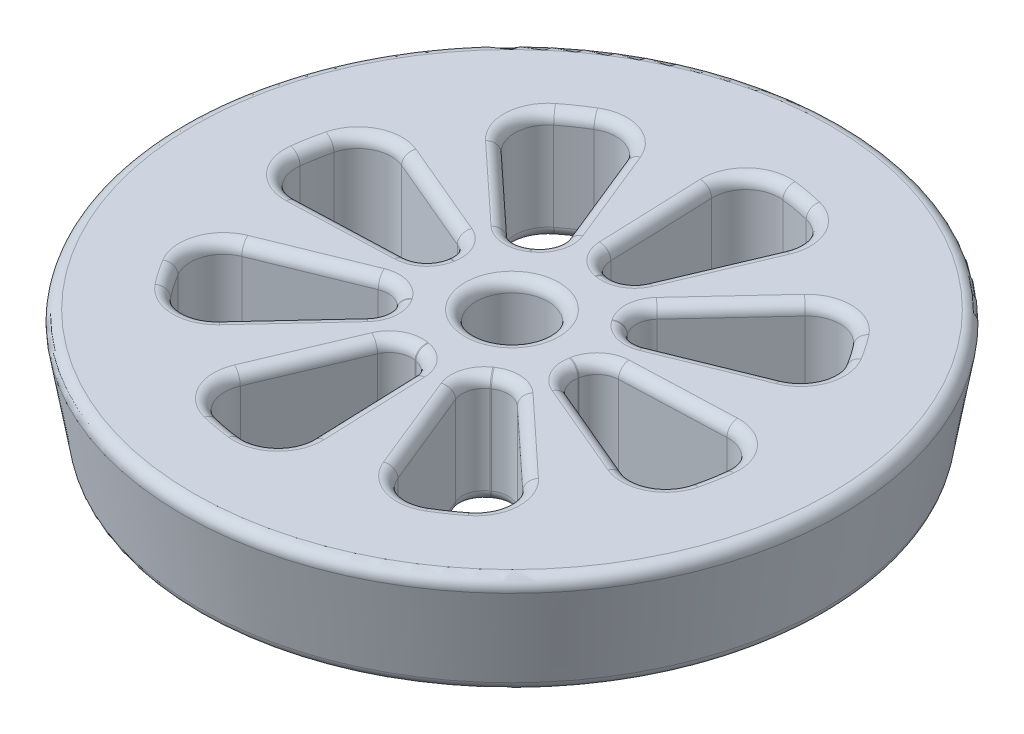
from build123d import *

# Parameters (mm, degrees)
SKETCH_1_R          = 30
SKETCH_1_R_2        = 22
EXTRUDE_1_DEPTH     = 10
SKETCH_1_R_3        = 7.5
SKETCH_1_R_4        = 3.25
EXTRUDE_1_2_DEPTH   = 10
EXTRUDE_3_DEPTH     = 10
FILLET_1_R          = 3
FILLET_3_R          = 2
SKETCH_3_R          = 58.089132302
SKETCH_3_R_2        = 30
CUT_EXTRUDE_1_DEPTH = 44.588989435
CUT_EXTRUDE_1_DRAFT = 10
FILLET_4_R          = 1


with BuildPart() as part:
    # 草圖1 → 填料-伸長1 (new body)
    with BuildSketch(Plane(origin=(0, 0, 0), x_dir=(1, 0, 0), z_dir=(0, 1, 0))):
        with Locations(Location((0, 0, 0), (0, 0, 270))):
            Circle(SKETCH_1_R)
        with Locations(Location((0, 0, 0), (0, 0, 270))):
            Circle(SKETCH_1_R_2, mode=Mode.SUBTRACT)
    extrude(amount=EXTRUDE_1_DEPTH)



with BuildPart() as body_2:
    # 草圖1 → Extrude 1 2 (new body)
    with BuildSketch(Plane(origin=(0, 0, 0), x_dir=(1, 0, 0), z_dir=(0, 1, 0))):
        with Locations(Location((0, 0, 0), (0, 0, 270))):
            Circle(SKETCH_1_R_3)
        with Locations(Location((0, 0, 0), (0, 0, 270))):
            Circle(SKETCH_1_R_4, mode=Mode.SUBTRACT)
    extrude(amount=EXTRUDE_1_2_DEPTH)


with BuildPart() as part_1:
    add(part.part)

    add(body_2.part)  # 填料-伸長3 merges body 2
    # 草圖2 → 填料-伸長3 (add, through all)
    with BuildSketch(Plane(origin=(0, 10, 0), x_dir=(1, 0, 0), z_dir=(0, 1, 0))):
        with BuildLine():
            Line((-8.281693583, 20.38169648), (-2.82330463, 6.948305618))
            ThreePointArc((-2.82330463, 6.948305618), (-1.573851681, 7.333006947), (-0.276578044, 7.494898571))
            Line((-0.276578044, 7.494898571), (-0.811295596, 21.985035807))
            ThreePointArc((-0.811295596, 21.985035807), (-4.616631597, 21.510153712), (-8.281693583, 20.38169648))
        make_face()
        with BuildLine():
            ThreePointArc((2.916816171, 6.90957187), (4.072337743, 6.298100135), (5.104123393, 5.495263814))
            Line((5.104123393, 5.495263814), (14.972095287, 16.119440522))
            ThreePointArc((14.972095287, 16.119440522), (11.945524046, 18.474427062), (8.555994101, 20.268077485))
            Line((8.555994101, 20.268077485), (2.916816171, 6.90957187))
        make_face()
        with BuildLine():
            ThreePointArc((6.948305618, 2.82330463), (7.333006947, 1.573851681), (7.494898571, 0.276578044))
            Line((7.494898571, 0.276578044), (21.985035807, 0.811295596))
            ThreePointArc((21.985035807, 0.811295596), (21.510153712, 4.616631597), (20.38169648, 8.281693583))
            Line((20.38169648, 8.281693583), (6.948305618, 2.82330463))
        make_face()
        with BuildLine():
            ThreePointArc((6.90957187, -2.916816171), (6.298100135, -4.072337743), (5.495263814, -5.104123393))
            Line((5.495263814, -5.104123393), (16.119440522, -14.972095287))
            ThreePointArc((16.119440522, -14.972095287), (18.474427062, -11.945524046), (20.268077485, -8.555994101))
            Line((20.268077485, -8.555994101), (6.90957187, -2.916816171))
        make_face()
        with BuildLine():
            ThreePointArc((2.82330463, -6.948305618), (1.573851681, -7.333006947), (0.276578044, -7.494898571))
            Line((0.276578044, -7.494898571), (0.811295596, -21.985035807))
            ThreePointArc((0.811295596, -21.985035807), (4.616631597, -21.510153712), (8.281693583, -20.38169648))
            Line((8.281693583, -20.38169648), (2.82330463, -6.948305618))
        make_face()
        with BuildLine():
            ThreePointArc((-2.916816171, -6.90957187), (-4.072337743, -6.298100135), (-5.104123393, -5.495263814))
            Line((-5.104123393, -5.495263814), (-14.972095287, -16.119440522))
            ThreePointArc((-14.972095287, -16.119440522), (-11.945524046, -18.474427062), (-8.555994101, -20.268077485))
            Line((-8.555994101, -20.268077485), (-2.916816171, -6.90957187))
        make_face()
        with BuildLine():
            ThreePointArc((-6.948305618, -2.82330463), (-7.333006947, -1.573851681), (-7.494898571, -0.276578044))
            Line((-7.494898571, -0.276578044), (-21.985035807, -0.811295596))
            ThreePointArc((-21.985035807, -0.811295596), (-21.510153712, -4.616631597), (-20.38169648, -8.281693583))
            Line((-20.38169648, -8.281693583), (-6.948305618, -2.82330463))
        make_face()
        with BuildLine():
            ThreePointArc((-6.90957187, 2.916816171), (-6.298100135, 4.072337743), (-5.495263814, 5.104123393))
            Line((-5.495263814, 5.104123393), (-16.119440522, 14.972095287))
            ThreePointArc((-16.119440522, 14.972095287), (-18.474427062, 11.945524046), (-20.268077485, 8.555994101))
            Line((-20.268077485, 8.555994101), (-6.90957187, 2.916816171))
        make_face()
    extrude(amount=-EXTRUDE_3_DEPTH)

    # 圓角1
    fillet_1_edges = [part_1.edges().sort_by_distance(p)[0] for p in [
        (20.268077485, 5, 8.555994101),
        (16.119440522, 5, 14.972095287),
        (20.38169648, 5, -8.281693583),
        (8.555994101, 5, -20.268077485),
        (21.985035807, 5, -0.811295596),
        (14.972095287, 5, -16.119440522),
        (-8.281693583, 5, -20.38169648),
        (-0.811295596, 5, -21.985035807),
        (-20.268077485, 5, -8.555994101),
        (-16.119440522, 5, -14.972095287),
        (-20.38169648, 5, 8.281693583),
        (-21.985035807, 5, 0.811295596),
        (-8.555994101, 5, 20.268077485),
        (-14.972095287, 5, 16.119440522),
        (8.281693583, 5, 20.38169648),
        (0.811295596, 5, 21.985035807),
    ]]
    fillet(fillet_1_edges, radius=FILLET_1_R)

    # 圓角3
    fillet_3_edges = [part_1.edges().sort_by_distance(p)[0] for p in [
        (5.495263814, 5, 5.104123393),
        (6.90957187, 5, 2.916816171),
        (5.104123393, 5, -5.495263814),
        (2.916816171, 5, -6.90957187),
        (7.494898571, 5, -0.276578044),
        (6.948305618, 5, -2.82330463),
        (-0.276578044, 5, -7.494898571),
        (-2.82330463, 5, -6.948305618),
        (-6.90957187, 5, -2.916816171),
        (-5.495263814, 5, -5.104123393),
        (-7.494898571, 5, 0.276578044),
        (-6.948305618, 5, 2.82330463),
        (-5.104123393, 5, 5.495263814),
        (-2.916816171, 5, 6.90957187),
        (0.276578044, 5, 7.494898571),
        (2.82330463, 5, 6.948305618),
    ]]
    fillet(fillet_3_edges, radius=FILLET_3_R)


with BuildPart() as cut_extrude_1_tool:
    # 草圖3 → 除料-伸長1 (with draft: the straight prism first)
    with BuildSketch(Plane(origin=(0, 10, 0), x_dir=(1, 0, 0), z_dir=(0, 1, 0))):
        Circle(SKETCH_3_R)
        Circle(SKETCH_3_R_2, mode=Mode.SUBTRACT)
    extrude(amount=-CUT_EXTRUDE_1_DEPTH)
    # 除料-伸長1: the draft: its side faces are tilted about the plane it starts from
    cut_extrude_1_sides = [cut_extrude_1_tool.faces().sort_by_distance(p)[0] for p in [
        (-58.089132302, -12.294494718, 0),
        (-30, -12.294494718, 0),
    ]]
    draft(cut_extrude_1_sides, Plane(origin=(0, 10, 0), x_dir=(1, 0, 0), z_dir=(0, 1, 0)), CUT_EXTRUDE_1_DRAFT)


with BuildPart() as part_2:
    add(part_1.part)

    # 除料-伸長1: cut by cut_extrude_1_tool
    add(cut_extrude_1_tool.part, mode=Mode.SUBTRACT)

    # 圓角4
    fillet_4_edges = [part_2.edges().sort_by_distance(p)[0] for p in [
        (-28.236730193, 0, 0),
        (5.790512054, 0, -5.581798918),
        (9.544285691, 10, -10.275685705),
        (9.544285691, 0, -10.275685705),
        (15.093494308, 0, -14.702360273),
        (18.10608233, 0, -12.496790894),
        (19.099795229, 0, -8.897796932),
        (12.992752874, 0, -5.279344543),
        (12.992752874, 10, -5.279344543),
        (7.272656884, 0, -3.434380709),
        (6.172528067, 0, -4.260269623),
        (8.041438206, 0, 0.147582474),
        (14.014836177, 10, -0.51717791),
        (14.014836177, 0, -0.51717791),
        (21.068850826, 0, 0.276573529),
        (3.966368012, 0, -21.639499181),
        (19.797287274, 0, 7.213902178),
        (12.920323991, 0, 5.454203337),
        (12.920323991, 10, 5.454203337),
        (7.571018888, 0, 2.714071111),
        (7.377101993, 0, 1.352170913),
        (5.581798918, 0, 5.790512054),
        (10.275685705, 10, 9.544285691),
        (10.275685705, 0, 9.544285691),
        (14.702360273, 0, 15.093494308),
        (8.897796932, 0, 19.099795229),
        (5.279344543, 0, 12.992752874),
        (5.279344543, 10, 12.992752874),
        (3.434380709, 0, 7.272656884),
        (4.260269623, 0, 6.172528067),
        (-0.147582474, 0, 8.041438206),
        (0.51717791, 10, 14.014836177),
        (0.51717791, 0, 14.014836177),
        (-0.276573529, 0, 21.068850826),
        (-7.213902178, 0, 19.797287274),
        (-5.454203337, 0, 12.920323991),
        (-5.454203337, 10, 12.920323991),
        (-2.714071111, 0, 7.571018888),
        (-1.352170913, 0, 7.377101993),
        (-5.790512054, 0, 5.581798918),
        (-9.544285691, 10, 10.275685705),
        (-9.544285691, 0, 10.275685705),
        (-15.093494308, 0, 14.702360273),
        (-19.099795229, 0, 8.897796932),
        (-12.992752874, 0, 5.279344543),
        (-12.992752874, 10, 5.279344543),
        (-7.272656884, 0, 3.434380709),
        (-6.172528067, 0, 4.260269623),
        (-5.581798918, 0, -5.790512054),
        (-10.275685705, 10, -9.544285691),
        (-10.275685705, 0, -9.544285691),
        (-14.702360273, 0, -15.093494308),
        (-8.897796932, 0, -19.099795229),
        (-5.279344543, 0, -12.992752874),
        (-5.279344543, 10, -12.992752874),
        (-3.434380709, 0, -7.272656884),
        (-4.260269623, 0, -6.172528067),
        (0.147582474, 0, -8.041438206),
        (-0.51717791, 10, -14.014836177),
        (-0.51717791, 0, -14.014836177),
        (0.276573529, 0, -21.068850826),
        (7.213902178, 0, -19.797287274),
        (5.454203337, 0, -12.920323991),
        (5.454203337, 10, -12.920323991),
        (2.714071111, 0, -7.571018888),
        (1.352170913, 0, -7.377101993),
        (-8.041438206, 0, -0.147582474),
        (-14.014836177, 10, 0.51717791),
        (-14.014836177, 0, 0.51717791),
        (-21.068850826, 0, -0.276573529),
        (-19.797287274, 0, -7.213902178),
        (-12.920323991, 0, -5.454203337),
        (-12.920323991, 10, -5.454203337),
        (-7.571018888, 0, -2.714071111),
        (-7.377101993, 0, -1.352170913),
        (0, 0, -3.25),
        (0, 10, -3.25),
        (-30, 10, 0),
        (-21.068850826, 10, -0.276573529),
        (-8.041438206, 10, -0.147582474),
        (-7.377101993, 10, -1.352170913),
        (-7.571018888, 10, -2.714071111),
        (-19.797287274, 10, -7.213902178),
        (18.10608233, 10, -12.496790894),
        (3.966368012, 10, -21.639499181),
        (2.714071111, 10, -7.571018888),
        (7.213902178, 10, -19.797287274),
        (0.276573529, 10, -21.068850826),
        (0.147582474, 10, -8.041438206),
        (1.352170913, 10, -7.377101993),
        (-3.434380709, 10, -7.272656884),
        (-8.897796932, 10, -19.099795229),
        (-14.702360273, 10, -15.093494308),
        (-5.581798918, 10, -5.790512054),
        (-4.260269623, 10, -6.172528067),
        (-19.099795229, 10, 8.897796932),
        (-15.093494308, 10, 14.702360273),
        (-5.790512054, 10, 5.581798918),
        (-6.172528067, 10, 4.260269623),
        (-7.272656884, 10, 3.434380709),
        (-7.213902178, 10, 19.797287274),
        (-0.276573529, 10, 21.068850826),
        (-0.147582474, 10, 8.041438206),
        (-1.352170913, 10, 7.377101993),
        (-2.714071111, 10, 7.571018888),
        (8.897796932, 10, 19.099795229),
        (14.702360273, 10, 15.093494308),
        (5.581798918, 10, 5.790512054),
        (4.260269623, 10, 6.172528067),
        (3.434380709, 10, 7.272656884),
        (19.797287274, 10, 7.213902178),
        (21.068850826, 10, 0.276573529),
        (8.041438206, 10, 0.147582474),
        (7.377101993, 10, 1.352170913),
        (7.571018888, 10, 2.714071111),
        (19.099795229, 10, -8.897796932),
        (15.093494308, 10, -14.702360273),
        (5.790512054, 10, -5.581798918),
        (6.172528067, 10, -4.260269623),
        (7.272656884, 10, -3.434380709),
    ]]
    fillet(fillet_4_edges, radius=FILLET_4_R)


solid = part_2.part
